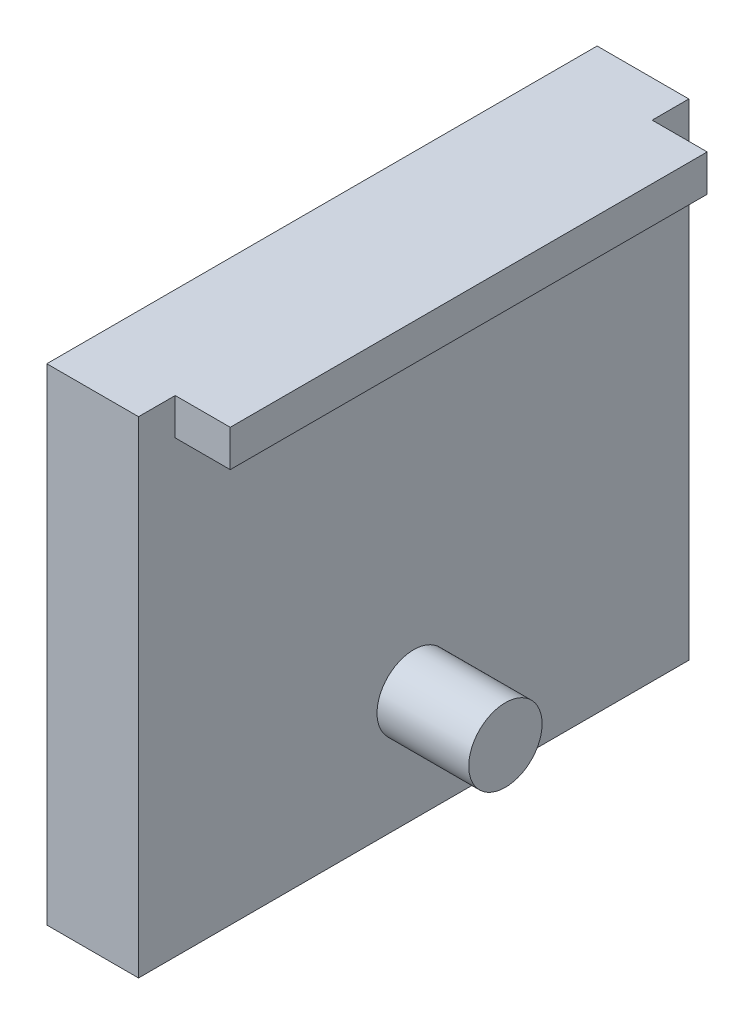
from build123d import *

# Parameters (mm, degrees)
SKETCH1_W           = 30
SKETCH1_H           = 26.5
BOSS_EXTRUDE1_DEPTH = 2.5
SKETCH2_W           = 22
SKETCH2_H           = 2
BOSS_EXTRUDE2_DEPTH = 0.5
SKETCH3_W           = 26
SKETCH3_H           = 2
BOSS_EXTRUDE3_DEPTH = 1.5
SKETCH4_R           = 2
BOSS_EXTRUDE4_DEPTH = 2.5


with BuildPart() as part:
    # Sketch1 → Boss-Extrude1 (new, symmetric)
    with BuildSketch(Plane(origin=(-179.150792305, 0, 0), x_dir=(0, 0, -1), z_dir=(1, 0, 0))):
        with Locations((-149, 50.25)):
            Rectangle(SKETCH1_W, SKETCH1_H)
    extrude(amount=BOSS_EXTRUDE1_DEPTH, both=True)

    # Sketch2 → Boss-Extrude2 (add, symmetric)
    with BuildSketch(Plane(origin=(-181.650792305, 0, 0), x_dir=(0, 0, -1), z_dir=(1, 0, 0))):
        with Locations((-149, 41)):
            Rectangle(SKETCH2_W, SKETCH2_H)
        with Locations((-149, 45)):
            Rectangle(SKETCH2_W, SKETCH2_H)
    extrude(amount=BOSS_EXTRUDE2_DEPTH, both=True)

    # Sketch3 → Boss-Extrude3 (add, symmetric)
    with BuildSketch(Plane(origin=(-175.150792305, 0, 0), x_dir=(0, 0, -1), z_dir=(1, 0, 0))):
        with Locations((-149, 62.5)):
            Rectangle(SKETCH3_W, SKETCH3_H)
    extrude(amount=BOSS_EXTRUDE3_DEPTH, both=True)

    # Sketch4 → Boss-Extrude4 (add, symmetric)
    with BuildSketch(Plane(origin=(-174.150792305, 0, 0), x_dir=(0, 0, -1), z_dir=(1, 0, 0))):
        with Locations((-149, 43)):
            Circle(SKETCH4_R)
    extrude(amount=BOSS_EXTRUDE4_DEPTH, both=True)


solid = part.part
